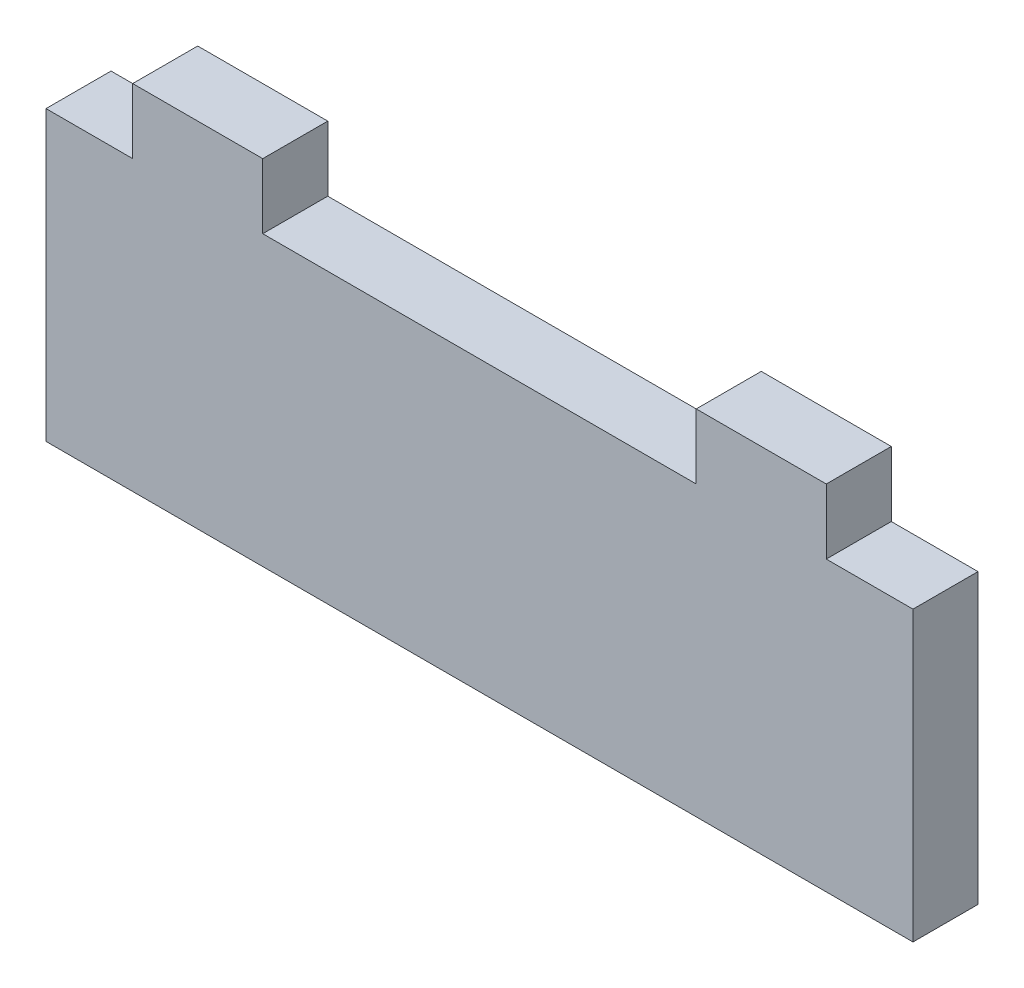
from build123d import *

# Parameters (mm, degrees)
SKETCH1_W           = 6
SKETCH1_H           = 3
BOSS_EXTRUDE1_DEPTH = 3


with BuildPart() as part:
    # Sketch1 → Boss-Extrude1 (new body)
    with BuildSketch(Plane.XY):
        Polygon((0, -6.65), (0, 6.65), (-10, 6.65), (-16, 6.65), (-20, 6.65), (-20, -6.65), align=None)
        Polygon((10, 6.65), (0, 6.65), (0, -6.65), (20, -6.65), (20, 6.65), (16, 6.65), align=None)
        with Locations((13, 8.15)):
            Rectangle(SKETCH1_W, SKETCH1_H)
        with Locations((-13, 8.15)):
            Rectangle(SKETCH1_W, SKETCH1_H)
    extrude(amount=BOSS_EXTRUDE1_DEPTH)


solid = part.part
